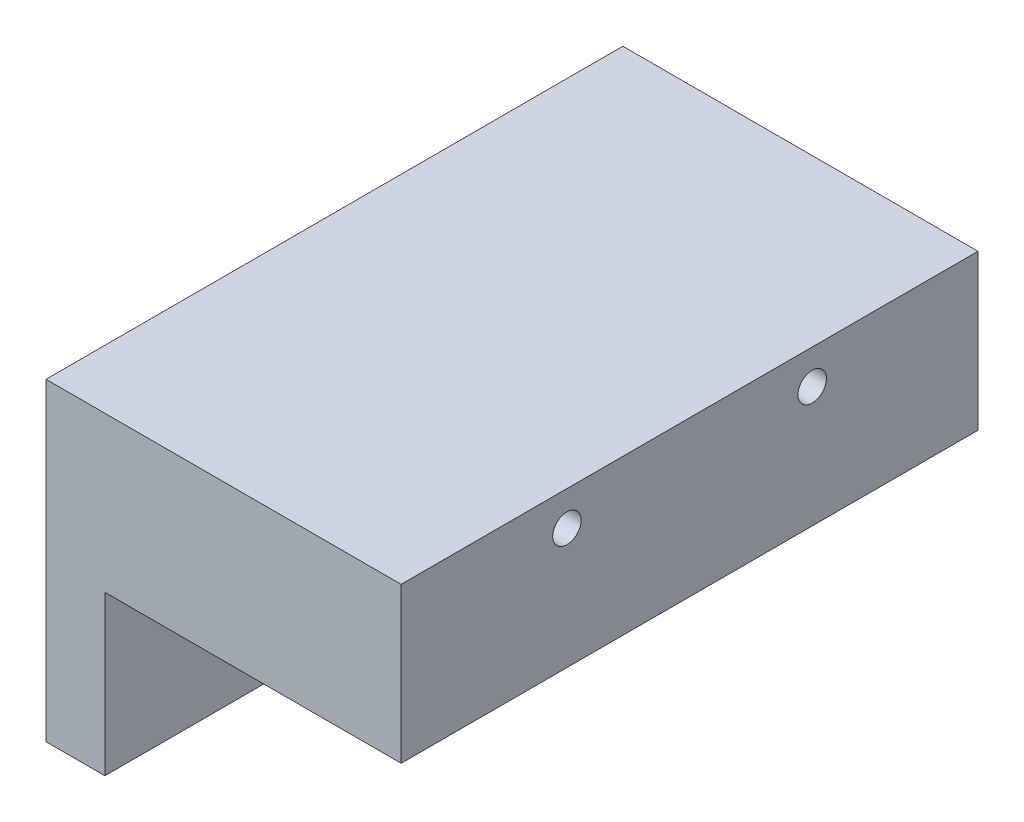
from build123d import *

# Parameters (mm, degrees)
SKETCH1_W           = 32
SKETCH1_H           = 58.8
SKETCH1_R           = 1.45
BOSS_EXTRUDE1_DEPTH = 6
BOSS_EXTRUDE2_START = 30.2
SKETCH1_3_W         = 15.8
SKETCH1_3_H         = 58.8
SKETCH1_3_R         = 1.45
BOSS_EXTRUDE2_DEPTH = 30.2


with BuildPart() as part:
    # Sketch1 → Boss-Extrude1 (new body)
    with BuildSketch(Plane.YZ):
        Rectangle(SKETCH1_W, SKETCH1_H)
        with Locations((12.5, -12.5)):
            Circle(SKETCH1_R, mode=Mode.SUBTRACT)
        with Locations((12.5, 12.5)):
            Circle(SKETCH1_R, mode=Mode.SUBTRACT)
        with Locations((-12.5, 12.5)):
            Circle(SKETCH1_R, mode=Mode.SUBTRACT)
        with Locations((-12.5, -12.5)):
            Circle(SKETCH1_R, mode=Mode.SUBTRACT)
    extrude(amount=-BOSS_EXTRUDE1_DEPTH)

    # Sketch1<3> → Boss-Extrude2 (add)
    with BuildSketch(Plane.YZ.offset(BOSS_EXTRUDE2_START)):
        with Locations((8.1, 0)):
            Rectangle(SKETCH1_3_W, SKETCH1_3_H)
        with Locations((12.5, -12.5)):
            Circle(SKETCH1_3_R, mode=Mode.SUBTRACT)
        with Locations((12.5, 12.5)):
            Circle(SKETCH1_3_R, mode=Mode.SUBTRACT)
    extrude(amount=-BOSS_EXTRUDE2_DEPTH)


solid = part.part
